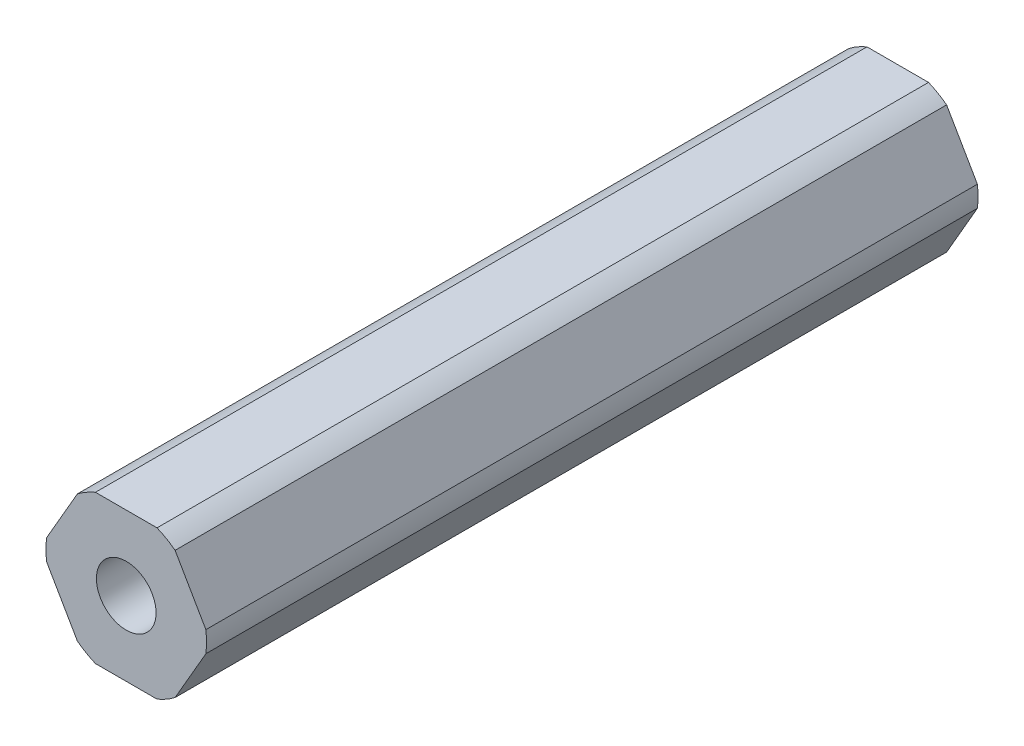
from build123d import *

# Parameters (mm, degrees)
SKETCH1_R           = 2.5527
BOSS_EXTRUDE1_DEPTH = 66.04


with BuildPart() as part:
    # Sketch1 → Boss-Extrude1 (new body)
    with BuildSketch(Plane.XY):
        with BuildLine():
            Line((6.816751826, 0.893039494), (4.181770802, 5.456960506))
            ThreePointArc((4.181770802, 5.456960506), (3.4375, 5.953924651), (2.634981025, 6.35))
            Line((2.634981025, 6.35), (-2.634981025, 6.35))
            ThreePointArc((-2.634981025, 6.35), (-3.4375, 5.953924651), (-4.181770802, 5.456960506))
            Line((-4.181770802, 5.456960506), (-6.816751826, 0.893039494))
            ThreePointArc((-6.816751826, 0.893039494), (-6.875, 0), (-6.816751826, -0.893039494))
            Line((-6.816751826, -0.893039494), (-4.181770802, -5.456960506))
            ThreePointArc((-4.181770802, -5.456960506), (-3.4375, -5.953924651), (-2.634981025, -6.35))
            Line((-2.634981025, -6.35), (2.634981025, -6.35))
            ThreePointArc((2.634981025, -6.35), (3.4375, -5.953924651), (4.181770802, -5.456960506))
            Line((4.181770802, -5.456960506), (6.816751826, -0.893039494))
            ThreePointArc((6.816751826, -0.893039494), (6.875, 0), (6.816751826, 0.893039494))
        make_face()
        Circle(SKETCH1_R, mode=Mode.SUBTRACT)
    extrude(amount=BOSS_EXTRUDE1_DEPTH)


solid = part.part
